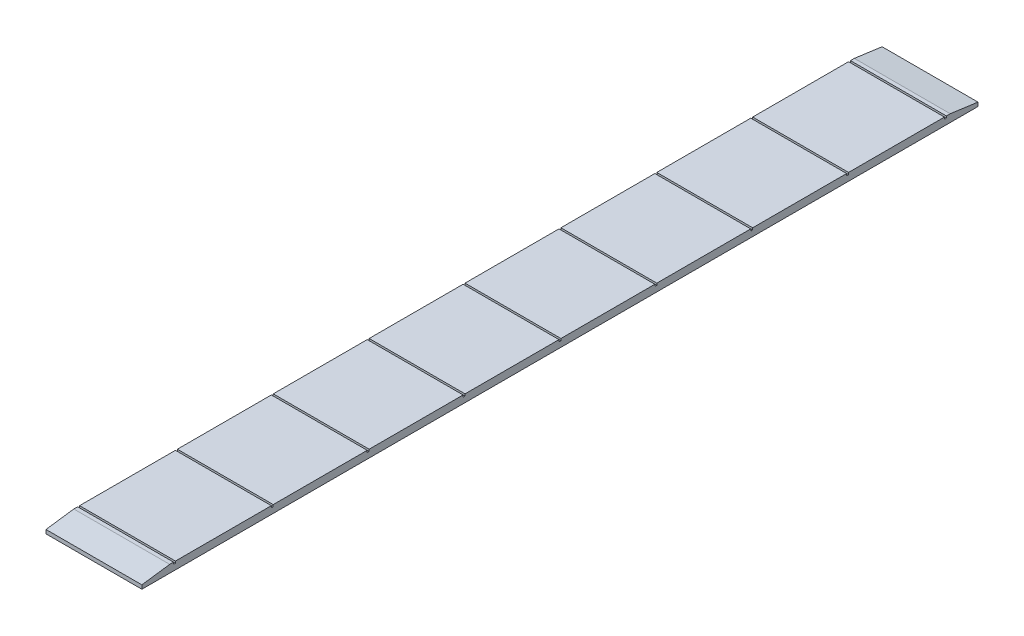
from build123d import *

# Parameters (mm, degrees)
SKETCH1_W           = 25
SKETCH1_H           = 220
BOSS_EXTRUDE1_DEPTH = 2
SKETCH2_W           = 25
SKETCH2_H           = 0.5
CUT_EXTRUDE1_DEPTH  = 0.5
SKETCH3_W           = 25
SKETCH3_H           = 2
CUT_EXTRUDE2_DEPTH  = 1
SKETCH4_W           = 25
SKETCH4_H           = 2
CUT_EXTRUDE3_DEPTH  = 1
CUT_EXTRUDE4_DEPTH  = 25


with BuildPart() as part:
    # Sketch1 → Boss-Extrude1 (new body)
    with BuildSketch(Plane(origin=(0, 0, 0), x_dir=(1, 0, 0), z_dir=(0, 1, 0))):
        with Locations((12.5, -110)):
            Rectangle(SKETCH1_W, SKETCH1_H)
    extrude(amount=BOSS_EXTRUDE1_DEPTH)

    # Sketch2 → Cut-Extrude1 (cut)
    with BuildSketch(Plane(origin=(0, 2, 0), x_dir=(1, 0, 0), z_dir=(0, 1, 0))):
        with Locations((12.5, -9.5)):
            Rectangle(SKETCH2_W, SKETCH2_H)
        with Locations((12.5, -210.5)):
            Rectangle(SKETCH2_W, SKETCH2_H)
        with Locations((12.5, -60)):
            Rectangle(SKETCH2_W, SKETCH2_H)
        with Locations((12.5, -35)):
            Rectangle(SKETCH2_W, SKETCH2_H)
        with Locations((12.5, -85)):
            Rectangle(SKETCH2_W, SKETCH2_H)
        with Locations((12.5, -110)):
            Rectangle(SKETCH2_W, SKETCH2_H)
        with Locations((12.5, -135)):
            Rectangle(SKETCH2_W, SKETCH2_H)
        with Locations((12.5, -160)):
            Rectangle(SKETCH2_W, SKETCH2_H)
        with Locations((12.5, -185)):
            Rectangle(SKETCH2_W, SKETCH2_H)
    extrude(amount=-CUT_EXTRUDE1_DEPTH, mode=Mode.SUBTRACT)

    # Sketch3 → Cut-Extrude2 (cut)
    with BuildSketch(Plane(origin=(0, 0, 0), x_dir=(-1, 0, 0), z_dir=(0, 0, -1))):
        with Locations((-12.5, 1)):
            Rectangle(SKETCH3_W, SKETCH3_H)
    extrude(amount=-CUT_EXTRUDE2_DEPTH, mode=Mode.SUBTRACT)

    # Sketch4 → Cut-Extrude3 (cut)
    with BuildSketch(Plane.XY.offset(220)):
        with Locations((12.5, 1)):
            Rectangle(SKETCH4_W, SKETCH4_H)
    extrude(amount=-CUT_EXTRUDE3_DEPTH, mode=Mode.SUBTRACT)

    # Sketch5 → Cut-Extrude4 (cut)
    with BuildSketch(Plane.ZY):
        Polygon((1, 1), (8.25, 2), (1, 2), align=None)
        Polygon((211.75, 2), (219, 1), (219, 2), align=None)
    extrude(amount=-CUT_EXTRUDE4_DEPTH, mode=Mode.SUBTRACT)


solid = part.part
